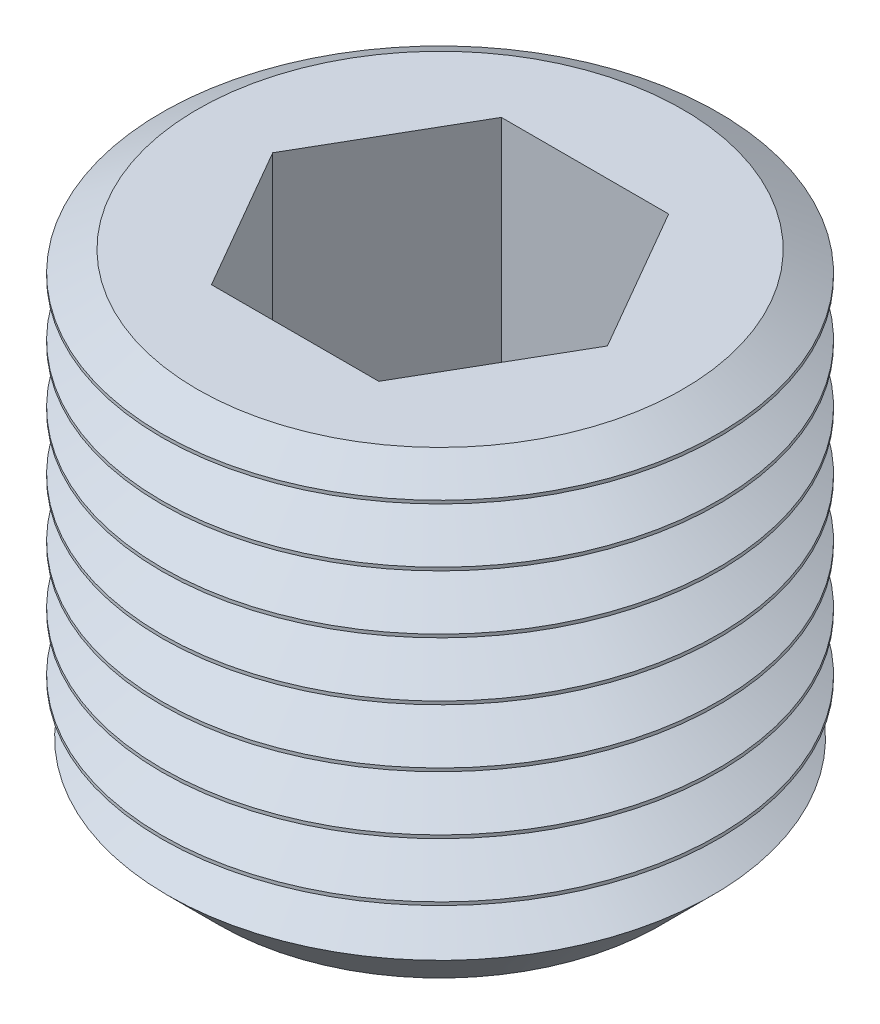
from build123d import *

# Parameters (mm, degrees)
CUT_EXTRUDE1_DEPTH = 2.5


with BuildPart() as part:
    # Sketch1 → Revolve1 (revolve)
    with BuildSketch(Plane(origin=(0, 0, 0), x_dir=(-1, 0, 0), z_dir=(0, 0, -1)), mode=Mode.PRIVATE) as revolve1_sk:
        Polygon((-1.9, -4.1), (0, -4.1), (0, 0), (-2.092745595, 0), (-2.4, -0.177393414), (-2.4, -0.205075547), (-1.990960729, -0.441234481), (-2.4, -0.677393414), (-2.4, -0.705075547), (-1.990960729, -0.941234481), (-2.4, -1.177393414), (-2.4, -1.205075547), (-1.990960729, -1.441234481), (-2.4, -1.677393414), (-2.4, -1.705075547), (-1.990960729, -1.94123448), (-2.4, -2.177393414), (-2.4, -2.205075547), (-1.990960729, -2.44123448), (-2.4, -2.677393414), (-2.4, -2.705075547), (-1.990960729, -2.941234481), (-2.4, -3.177393414), (-2.4, -3.205075547), (-1.990960729, -3.441234481), (-2.350934542, -3.649065458), align=None)
    revolve(revolve1_sk.sketch.rotate(Axis((0, -4.1, 0), (0, 1, 0)), 270), axis=Axis((0, -4.1, 0), (0, 1, 0)))

    # Sketch2 → Cut-Extrude1 (cut)
    with BuildSketch(Plane(origin=(0, 0, 0), x_dir=(-1, 0, 0), z_dir=(0, 1, 0))):
        Polygon((0.721687836, -1.25), (1.443375673, 0), (0.721687836, 1.25), (-0.721687836, 1.25), (-1.443375673, 0), (-0.721687836, -1.25), align=None)
    extrude(amount=-CUT_EXTRUDE1_DEPTH, mode=Mode.SUBTRACT)


solid = part.part
